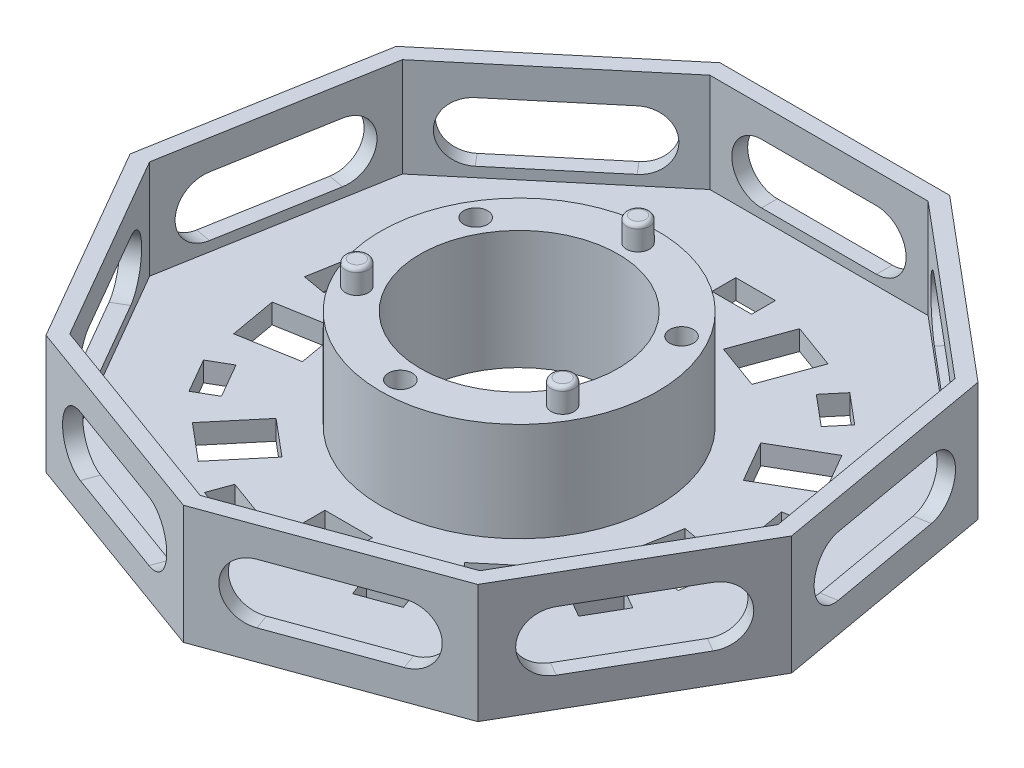
from build123d import *

# Parameters (mm, degrees)
ESBO_O1_R                  = 25
RESSALTO_EXTRUS_O1_DEPTH   = 30
ESBO_O2_R                  = 35
CORTE_EXTRUS_O1_DEPTH      = 25
ESBO_O3_R                  = 2.9
RESSALTO_EXTRUS_O2_DEPTH   = 6
ESBO_O4_R                  = 3
CORTE_EXTRUS_O2_DEPTH      = 123.727390525
CORTE_EXTRUS_O3_REACH      = 189.931
PADR_OCIRCULAR1_COUNT      = 9
CORTE_EXTRUS_O4_DEPTH      = 123.975657693
CORTE_EXTRUS_O4_DEPTH_BACK = 123.975657693
ESBO_O7_W                  = 10
ESBO_O7_H                  = 6
ESBO_O7_W_2                = 12
ESBO_O7_H_2                = 15
FILETE1_R                  = 1


with BuildPart() as part:
    # Esboço1 → Ressalto-extrusão1 (new body)
    with BuildSketch(Plane(origin=(0, 0, 0), x_dir=(1, 0, 0), z_dir=(0, 1, 0))):
        Polygon((-73.430577701, 42.395163802), (-83.502172006, -14.723685872), (-54.502172006, -64.953159292), (0, -84.790327605), (54.502172006, -64.953159292), (83.502172006, -14.723685872), (73.430577701, 42.395163802), (29, 79.676845164), (-29, 79.676845164), align=None)
        with Locations(Location((0, 0, 0), (0, 0, 270))):
            Circle(ESBO_O1_R, mode=Mode.SUBTRACT)
    extrude(amount=RESSALTO_EXTRUS_O1_DEPTH)

    # Esboço2 → Corte-extrusão1 (cut)
    with BuildSketch(Plane(origin=(0, 30, 0), x_dir=(1, 0, 0), z_dir=(0, 1, 0))):
        Polygon((-79.310129922, -13.984515749), (-51.766010859, -61.692329415), (0, -80.533616515), (51.766010859, -61.692329415), (79.310129922, -13.984515749), (69.74415776, 40.266808257), (27.544119063, 75.676845164), (-27.544119063, 75.676845164), (-69.74415776, 40.266808257), align=None)
        with Locations(Location((0, 0, 0), (0, 0, 270))):
            Circle(ESBO_O2_R, mode=Mode.SUBTRACT)
    extrude(amount=-CORTE_EXTRUS_O1_DEPTH, mode=Mode.SUBTRACT)

    # Esboço3 → Ressalto-extrusão2 (add)
    with BuildSketch(Plane(origin=(0, 30, 0), x_dir=(1, 0, 0), z_dir=(0, 1, 0))):
        with Locations(Location((0, 30, 0), (0, 0, 90))):
            Circle(ESBO_O3_R)
        with Locations(Location((25.980762114, -15, 0), (0, 0, 90))):
            Circle(ESBO_O3_R)
        with Locations(Location((-25.980762114, -15, 0), (0, 0, 90))):
            Circle(ESBO_O3_R)
    extrude(amount=RESSALTO_EXTRUS_O2_DEPTH)

    # Esboço4 → Corte-extrusão2 (cut, through all)
    with BuildSketch(Plane(origin=(0, 30, 0), x_dir=(1, 0, 0), z_dir=(0, 1, 0))):
        with Locations(Location((0, -30, 0), (0, 0, 270))):
            Circle(ESBO_O4_R)
        with Locations(Location((-25.980762114, 15, 0), (0, 0, 270))):
            Circle(ESBO_O4_R)
        with Locations(Location((25.980762114, 15, 0), (0, 0, 270))):
            Circle(ESBO_O4_R)
    extrude(amount=-CORTE_EXTRUS_O2_DEPTH, mode=Mode.SUBTRACT)

    # Esboço5 → Corte-extrusão3 (cut, up to next)
    with BuildSketch(Plane(origin=(0, 0, -79.676845164), x_dir=(-1, 0, 0), z_dir=(0, 0, -1)), mode=Mode.PRIVATE) as corte_extrus_o3_sk1:
        with BuildLine():
            Line((-14.5, 22.5), (14.5, 22.5))
            ThreePointArc((14.5, 22.5), (22, 15), (14.5, 7.5))
            Line((14.5, 7.5), (-14.5, 7.5))
            ThreePointArc((-14.5, 7.5), (-22, 15), (-14.5, 22.5))
        make_face()
    corte_extrus_o3_tool1 = extrude(corte_extrus_o3_sk1.sketch, amount=-CORTE_EXTRUS_O3_REACH, mode=Mode.PRIVATE) & part.part
    corte_extrus_o3 = corte_extrus_o3_tool1.solids().sort_by_distance((0, 15, -79.676845))[0]
    add(corte_extrus_o3, mode=Mode.SUBTRACT)

    # PadrãoCircular1: Corte-extrusão3 ×9 about axis
    padr_ocircular1_axis = Axis((0, 0, 0), (0, 1, 0))
    for i in range(1, PADR_OCIRCULAR1_COUNT):
        add(corte_extrus_o3.rotate(padr_ocircular1_axis, i * 360 / PADR_OCIRCULAR1_COUNT), mode=Mode.SUBTRACT)

    # Esboço7 → Corte-extrusão4 (cut, two sides: drawn at the far end of the back side and taken through both)
    with BuildSketch(Plane(origin=(0, 5, 0), x_dir=(1, 0, 0), z_dir=(0, 1, 0)).offset(-CORTE_EXTRUS_O4_DEPTH_BACK)):
        Polygon((30.672588783, 44.332787011), (38.333033214, 37.904910914), (42.189758872, 42.501177572), (34.529314441, 48.929053669), align=None)
        with Locations((0, 56.676845164)):
            Rectangle(ESBO_O7_W, ESBO_O7_H)
        Polygon((51.993132387, 14.244925111), (53.729614163, 4.396847581), (59.638460681, 5.438736647), (57.901978905, 15.286814177), align=None)
        Polygon((48.985511507, -22.508295563), (43.985511507, -31.168549601), (49.18166393, -34.168549601), (54.18166393, -25.508295563), align=None)
        Polygon((23.05702538, -48.729634591), (13.660099172, -52.149836024), (15.712220032, -57.787991749), (25.10914624, -54.367790316), align=None)
        Polygon((-13.660099172, -52.149836024), (-23.05702538, -48.729634591), (-25.10914624, -54.367790316), (-15.712220032, -57.787991749), align=None)
        Polygon((-43.985511507, -31.168549601), (-48.985511507, -22.508295563), (-54.18166393, -25.508295563), (-49.18166393, -34.168549601), align=None)
        Polygon((-53.729614163, 4.396847581), (-51.993132387, 14.244925111), (-57.901978905, 15.286814177), (-59.638460681, 5.438736647), align=None)
        Polygon((-38.333033214, 37.904910914), (-30.672588783, 44.332787011), (-34.529314441, 48.929053669), (-42.189758872, 42.501177572), align=None)
        Polygon((-23.065208837, -36.822388457), (-32.257742154, -29.10893714), (-41.8995563, -40.599603787), (-32.707022982, -48.313055103), align=None)
        with Locations((0, -50.533616515)):
            Rectangle(ESBO_O7_W_2, ESBO_O7_H_2)
        Polygon((-41.337950118, -13.381555604), (-43.42172825, -1.563862568), (-58.193844545, -4.168585233), (-56.110066413, -15.986278269), align=None)
        Polygon((-40.268205119, 16.320655835), (-34.268205119, 26.71296068), (-47.258586175, 34.21296068), (-53.258586175, 23.820655835), align=None)
        Polygon((-20.356519413, 38.386251025), (-9.080207964, 42.490492745), (-14.210510113, 56.585882056), (-25.486821563, 52.481640337), align=None)
        Polygon((9.080207964, 42.490492745), (20.356519413, 38.386251025), (25.486821563, 52.481640337), (14.210510113, 56.585882056), align=None)
        Polygon((34.268205119, 26.71296068), (40.268205119, 16.320655835), (53.258586175, 23.820655835), (47.258586175, 34.21296068), align=None)
        Polygon((43.42172825, -1.563862568), (41.337950118, -13.381555604), (56.110066413, -15.986278269), (58.193844545, -4.168585233), align=None)
        Polygon((32.257742154, -29.10893714), (23.065208837, -36.822388457), (32.707022982, -48.313055103), (41.8995563, -40.599603787), align=None)
    extrude(amount=CORTE_EXTRUS_O4_DEPTH + CORTE_EXTRUS_O4_DEPTH_BACK, mode=Mode.SUBTRACT)

    # Filete1
    filete1_edges = [part.edges().sort_by_distance(p)[0] for p in [
        (0, 36, -27.1),
        (25.980762114, 36, 17.9),
        (-25.980762114, 36, 17.9),
    ]]
    fillet(filete1_edges, radius=FILETE1_R)


solid = part.part
